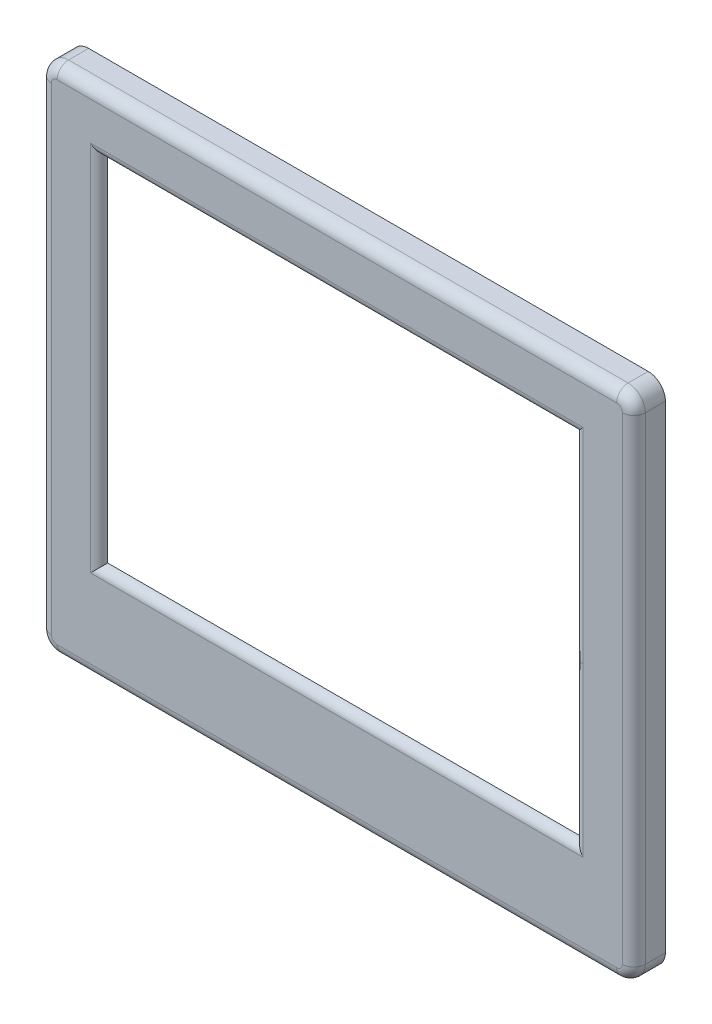
from build123d import *

# Parameters (mm, degrees)
SKETCH_1_R          = 1.65
EXTRUDE_1_DEPTH     = 4
EXTRUDE_START       = 1.5
SKETCH_1_3_R        = 1.65
SKETCH_1_3_W        = 91.5
SKETCH_1_3_H        = 77.5
SKETCH_1_3_W_2      = 85.9
SKETCH_1_3_H_2      = 64.9
SKETCH_1_3_W_3      = 17.5
SKETCH_1_3_H_3      = 2.5
EXTRUDE_2_DEPTH     = 1.5
FILLET_1_R          = 2
FILLET_2_R          = 1
CUT_EXTRUDE_START   = -4
CUT_EXTRUDE_1_DEPTH = 4
SKETCH_5_W          = 2.5
SKETCH_5_H          = 4.652730878
SKETCH_5_W_2        = 1
CUT_EXTRUDE_2_DEPTH = 1


with BuildPart() as part:
    # 草图1 → 凸台-拉伸1 (new body)
    with BuildSketch(Plane.XY):
        with BuildLine():
            Line((48.768130557, 44.382842821), (-48.768130557, 44.382842821))
            ThreePointArc((-48.768130557, 44.382842821), (-50.8894509, 43.504163165), (-51.768130557, 41.382842821))
            Line((-51.768130557, 41.382842821), (-51.768130557, -41.882842821))
            ThreePointArc((-51.768130557, -41.882842821), (-50.8894509, -44.004163165), (-48.768130557, -44.882842821))
            Line((-48.768130557, -44.882842821), (48.768130557, -44.882842821))
            ThreePointArc((48.768130557, -44.882842821), (50.8894509, -44.004163165), (51.768130557, -41.882842821))
            Line((51.768130557, -41.882842821), (51.768130557, 41.382842821))
            ThreePointArc((51.768130557, 41.382842821), (50.8894509, 43.504163165), (48.768130557, 44.382842821))
        make_face()
        with Locations((-48.268130557, -40.882842821)):
            Circle(SKETCH_1_R, mode=Mode.SUBTRACT)
        Polygon((-45.75, -38.75), (-45.75, 38.75), (45.75, 38.75), (45.75, -38.75), (8.75, -38.75), (8.75, -41.25), (-8.75, -41.25), (-8.75, -38.75), align=None, mode=Mode.SUBTRACT)
        with Locations((48.268130557, -40.882842821)):
            Circle(SKETCH_1_R, mode=Mode.SUBTRACT)
        with Locations((-48.268130557, 40.882842821)):
            Circle(SKETCH_1_R, mode=Mode.SUBTRACT)
        with Locations((48.268130557, 40.882842821)):
            Circle(SKETCH_1_R, mode=Mode.SUBTRACT)
    extrude(amount=-EXTRUDE_1_DEPTH)

    # 草图1<3> → 凸台-拉伸2 (add)
    # profile 1 of 7: a face of its own
    with BuildSketch(Plane.XY.offset(EXTRUDE_START)):
        with BuildLine():
            Line((-48.768130557, 44.382842821), (48.768130557, 44.382842821))
            ThreePointArc((48.768130557, 44.382842821), (50.8894509, 43.504163165), (51.768130557, 41.382842821))
            Line((51.768130557, 41.382842821), (51.768130557, -41.882842821))
            ThreePointArc((51.768130557, -41.882842821), (50.8894509, -44.004163165), (48.768130557, -44.882842821))
            Line((48.768130557, -44.882842821), (-48.768130557, -44.882842821))
            ThreePointArc((-48.768130557, -44.882842821), (-50.8894509, -44.004163165), (-51.768130557, -41.882842821))
            Line((-51.768130557, -41.882842821), (-51.768130557, 41.382842821))
            ThreePointArc((-51.768130557, 41.382842821), (-50.8894509, 43.504163165), (-48.768130557, 44.382842821))
        make_face()
        with Locations((48.268130557, 40.882842821)):
            Circle(SKETCH_1_3_R, mode=Mode.SUBTRACT)
        with Locations((-48.268130557, 40.882842821)):
            Circle(SKETCH_1_3_R, mode=Mode.SUBTRACT)
        with Locations((-48.268130557, -40.882842821)):
            Circle(SKETCH_1_3_R, mode=Mode.SUBTRACT)
        with Locations((48.268130557, -40.882842821)):
            Circle(SKETCH_1_3_R, mode=Mode.SUBTRACT)
        Rectangle(SKETCH_1_3_W, SKETCH_1_3_H, mode=Mode.SUBTRACT)
    # profile 2 of 7: a face of its own
    with BuildSketch(Plane.XY.offset(EXTRUDE_START)):
        with Locations((-48.268130557, -40.882842821)):
            Circle(SKETCH_1_3_R)
    # profile 3 of 7: a face of its own
    with BuildSketch(Plane.XY.offset(EXTRUDE_START)):
        with Locations((48.268130557, -40.882842821)):
            Circle(SKETCH_1_3_R)
    # profile 4 of 7: a face of its own
    with BuildSketch(Plane.XY.offset(EXTRUDE_START)):
        with Locations((48.268130557, 40.882842821)):
            Circle(SKETCH_1_3_R)
    # profile 5 of 7: a face of its own
    with BuildSketch(Plane.XY.offset(EXTRUDE_START)):
        with Locations((-48.268130557, 40.882842821)):
            Circle(SKETCH_1_3_R)
    # profile 6 of 7: a face of its own
    with BuildSketch(Plane.XY.offset(EXTRUDE_START)):
        Rectangle(SKETCH_1_3_W, SKETCH_1_3_H)
        with Locations((0, 3.3)):
            Rectangle(SKETCH_1_3_W_2, SKETCH_1_3_H_2, mode=Mode.SUBTRACT)
    # profile 7 of 7: a face of its own
    with BuildSketch(Plane.XY.offset(EXTRUDE_START)):
        with Locations((0, -40)):
            Rectangle(SKETCH_1_3_W_3, SKETCH_1_3_H_3)
    extrude(amount=-EXTRUDE_2_DEPTH)

    # 圆角1
    fillet_1_edges = [part.edges().sort_by_distance(p)[0] for p in [
        (0, 44.382842821, 1.5),
        (50.8894509, -44.004163165, 1.5),
        (51.768130557, -0.25, 1.5),
        (-50.8894509, 43.504163165, 1.5),
        (-51.768130557, -0.25, 1.5),
        (-50.8894509, -44.004163165, 1.5),
        (0, -44.882842821, 1.5),
        (50.8894509, 43.504163165, 1.5),
    ]]
    fillet(fillet_1_edges, radius=FILLET_1_R)

    # 圆角2
    fillet_2_edges = [part.edges().sort_by_distance(p)[0] for p in [
        (0, -41.25, -4),
        (-27.25, -38.75, -4),
        (-45.75, 0, -4),
        (0, 38.75, -4),
        (45.75, 0, -4),
        (27.25, -38.75, -4),
    ]]
    fillet(fillet_2_edges, radius=FILLET_2_R)

    # 草图2 → 切除-拉伸1 (cut)
    with BuildSketch(Plane(origin=(0, 0, -4), x_dir=(-1, 0, 0), z_dir=(0, 0, -1)).offset(CUT_EXTRUDE_START)):
        with BuildLine():
            Line((-46.015064843, 36.8), (-45.484935157, 36.8))
            ThreePointArc((-45.484935157, 36.8), (-41.25, 35), (-45.484935157, 33.2))
            Line((-45.484935157, 33.2), (-46.015064843, 33.2))
            ThreePointArc((-46.015064843, 33.2), (-50.25, 35), (-46.015064843, 36.8))
        make_face()
        with BuildLine():
            Line((46.015064843, 33.2), (45.484935157, 33.2))
            ThreePointArc((45.484935157, 33.2), (41.25, 35), (45.484935157, 36.8))
            Line((45.484935157, 36.8), (46.015064843, 36.8))
            ThreePointArc((46.015064843, 36.8), (50.25, 35), (46.015064843, 33.2))
        make_face()
        with BuildLine():
            Line((46.015064843, -36.8), (45.484935157, -36.8))
            ThreePointArc((45.484935157, -36.8), (41.25, -35), (45.484935157, -33.2))
            Line((45.484935157, -33.2), (46.015064843, -33.2))
            ThreePointArc((46.015064843, -33.2), (50.25, -35), (46.015064843, -36.8))
        make_face()
        with BuildLine():
            Line((-46.015064843, -33.2), (-45.484935157, -33.2))
            ThreePointArc((-45.484935157, -33.2), (-41.25, -35), (-45.484935157, -36.8))
            Line((-45.484935157, -36.8), (-46.015064843, -36.8))
            ThreePointArc((-46.015064843, -36.8), (-50.25, -35), (-46.015064843, -33.2))
        make_face()
    extrude(amount=CUT_EXTRUDE_1_DEPTH, mode=Mode.SUBTRACT)

    # 扫描1: sweep along a path in 草图3
    with BuildLine(Plane(origin=(0, 0, 0), x_dir=(-1, 0, 0), z_dir=(0, 0, -1))) as sweep_1_path:
        Line((41.45, 34.25), (41.45, -27.65))
        Line((41.45, -27.65), (-41.45, -27.65))
        Line((-41.45, -27.65), (-41.45, 34.25))
        Line((-41.45, 34.25), (41.45, 34.25))
    # 草图4 → 扫描1 (sweep)
    with BuildSketch(Plane(origin=(0, 0, 0), x_dir=(1, 0, 0), z_dir=(0, 1, 0))):
        with BuildLine():
            Line((41.45, 0), (42.95, 0))
            Line((42.95, 0), (42.95, -1.5))
            ThreePointArc((42.95, -1.5), (41.889339828, -1.060660172), (41.45, 0))
        make_face()
    sweep(path=sweep_1_path.line, transition=Transition.RIGHT)

    # 草图5 → 切除-拉伸2 (cut)
    with BuildSketch(Plane(origin=(0, 0, -4), x_dir=(-1, 0, 0), z_dir=(0, 0, -1))):
        with Locations((48, 7.013523993)):
            Rectangle(SKETCH_5_W, SKETCH_5_H)
        with Locations((46.25, 7.013523993)):
            Rectangle(SKETCH_5_W_2, SKETCH_5_H)
    extrude(amount=-CUT_EXTRUDE_2_DEPTH, mode=Mode.SUBTRACT)


solid = part.part
